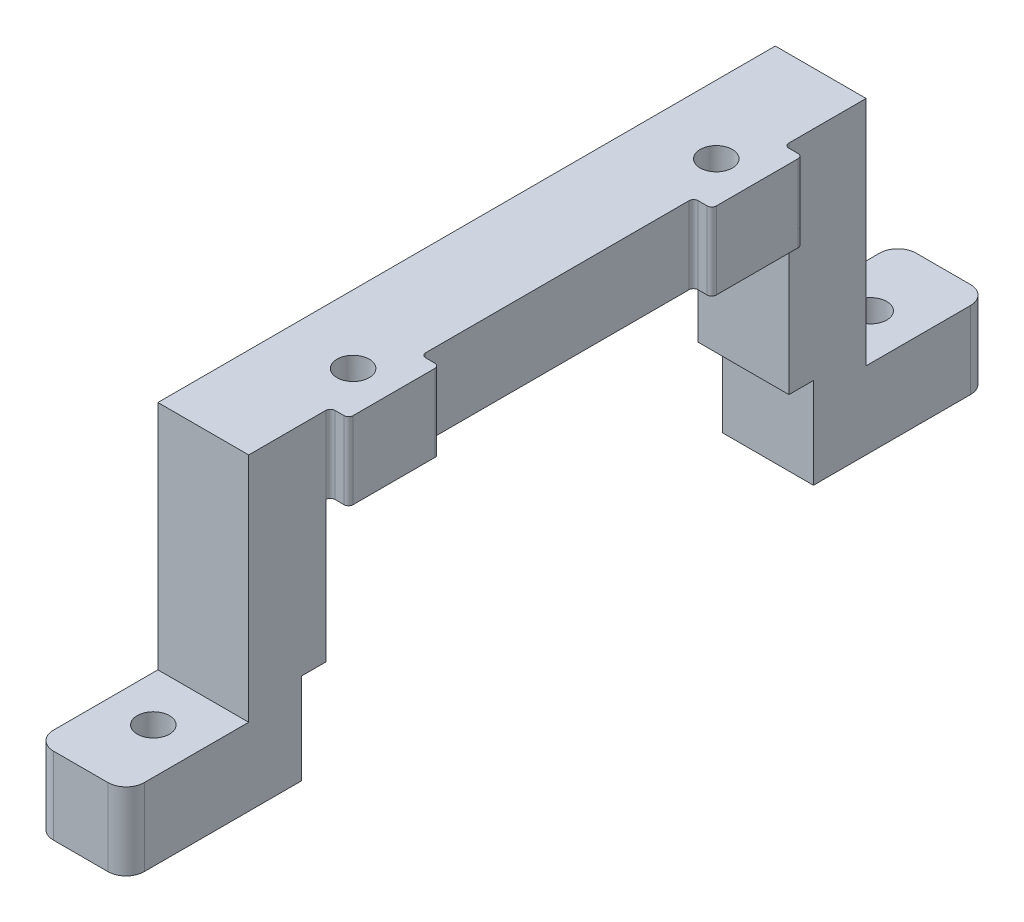
from build123d import *

# Parameters (mm, degrees)
BOSS_EXTRUDE1_DEPTH = 10
SKETCH2_R           = 1.775
CUT_EXTRUDE1_DEPTH  = 112.599557576
SKETCH3_W           = 10
SKETCH3_H           = 8.5
BOSS_EXTRUDE2_DEPTH = 2
SKETCH4_R           = 1.775
CUT_EXTRUDE2_DEPTH  = 115.036008573
FILLET2_R           = 0.5
FILLET3_R           = 2
SKETCH5_W           = 10
SKETCH5_H           = 56.4
CUT_EXTRUDE3_DEPTH  = 10
SKETCH6_R           = 3.25
CUT_EXTRUDE4_DEPTH  = 5


with BuildPart() as part:
    # Sketch1 → Boss-Extrude1 (new body)
    with BuildSketch(Plane(origin=(0, 0, 0), x_dir=(0, 0, -1), z_dir=(1, 0, 0))):
        Polygon((-108.186003028, 9.249121329), (-86.186003028, 9.249121329), (-86.186003028, 34.749121329), (-35.186003028, 34.749121329), (-35.186003028, 9.249121329), (-13.186003028, 9.249121329), (-13.186003028, 17.749121329), (-26.686003028, 17.749121329), (-26.686003028, 43.249121329), (-94.686003028, 43.249121329), (-94.686003028, 17.749121329), (-108.186003028, 17.749121329), align=None)
    extrude(amount=BOSS_EXTRUDE1_DEPTH)

    # Sketch2 → Cut-Extrude1 (cut, through all)
    with BuildSketch(Plane(origin=(0, 17.749121329, 0), x_dir=(1, 0, 0), z_dir=(0, 1, 0))):
        with Locations(Location((5, -100.186003028, 0), (0, 0, 270))):
            Circle(SKETCH2_R)
        with Locations(Location((5, -21.186003028, 0), (0, 0, 270))):
            Circle(SKETCH2_R)
    extrude(amount=-CUT_EXTRUDE1_DEPTH, mode=Mode.SUBTRACT)

    # Sketch3 → Boss-Extrude2 (add)
    with BuildSketch(Plane(origin=(10, 0, 0), x_dir=(0, 0, -1), z_dir=(1, 0, 0))):
        with Locations((-80.686003028, 38.999121329)):
            Rectangle(SKETCH3_W, SKETCH3_H)
        with Locations((-40.686003028, 38.999121329)):
            Rectangle(SKETCH3_W, SKETCH3_H)
    extrude(amount=BOSS_EXTRUDE2_DEPTH)

    # Sketch4 → Cut-Extrude2 (cut, through all)
    with BuildSketch(Plane(origin=(0, 43.249121329, 0), x_dir=(1, 0, 0), z_dir=(0, 1, 0))):
        with Locations(Location((7.5, -80.686003028, 0), (0, 0, 270))):
            Circle(SKETCH4_R)
        with Locations(Location((7.5, -40.686003028, 0), (0, 0, 270))):
            Circle(SKETCH4_R)
    extrude(amount=-CUT_EXTRUDE2_DEPTH, mode=Mode.SUBTRACT)

    # Fillet2
    fillet2_edges = [part.edges().sort_by_distance(p)[0] for p in [
        (10, 38.999121329, 35.686003028),
        (10, 38.999121329, 45.686003028),
        (12, 38.999121329, 35.686003028),
        (12, 38.999121329, 45.686003028),
        (10, 38.999121329, 75.686003028),
        (12, 38.999121329, 75.686003028),
        (12, 38.999121329, 85.686003028),
        (10, 38.999121329, 85.686003028),
    ]]
    fillet(fillet2_edges, radius=FILLET2_R)

    # Fillet3
    fillet3_edges = [part.edges().sort_by_distance(p)[0] for p in [
        (0, 13.499121329, 13.186003028),
        (0, 13.499121329, 108.186003028),
        (10, 13.499121329, 13.186003028),
        (10, 13.499121329, 108.186003028),
    ]]
    fillet(fillet3_edges, radius=FILLET3_R)

    # Sketch5 → Cut-Extrude3 (cut)
    with BuildSketch(Plane.XZ.offset(-9.249121329)):
        with Locations((5, 60.686003028)):
            Rectangle(SKETCH5_W, SKETCH5_H)
    extrude(amount=-CUT_EXTRUDE3_DEPTH, mode=Mode.SUBTRACT)

    # Sketch6 → Cut-Extrude4 (cut)
    with BuildSketch(Plane.XZ.offset(-34.749121329)):
        with Locations(Location((7.5, 80.686003028, 0), (0, 0, 270))):
            Circle(SKETCH6_R)
        with Locations(Location((7.5, 40.686003028, 0), (0, 0, 270))):
            Circle(SKETCH6_R)
    extrude(amount=-CUT_EXTRUDE4_DEPTH, mode=Mode.SUBTRACT)


solid = part.part
